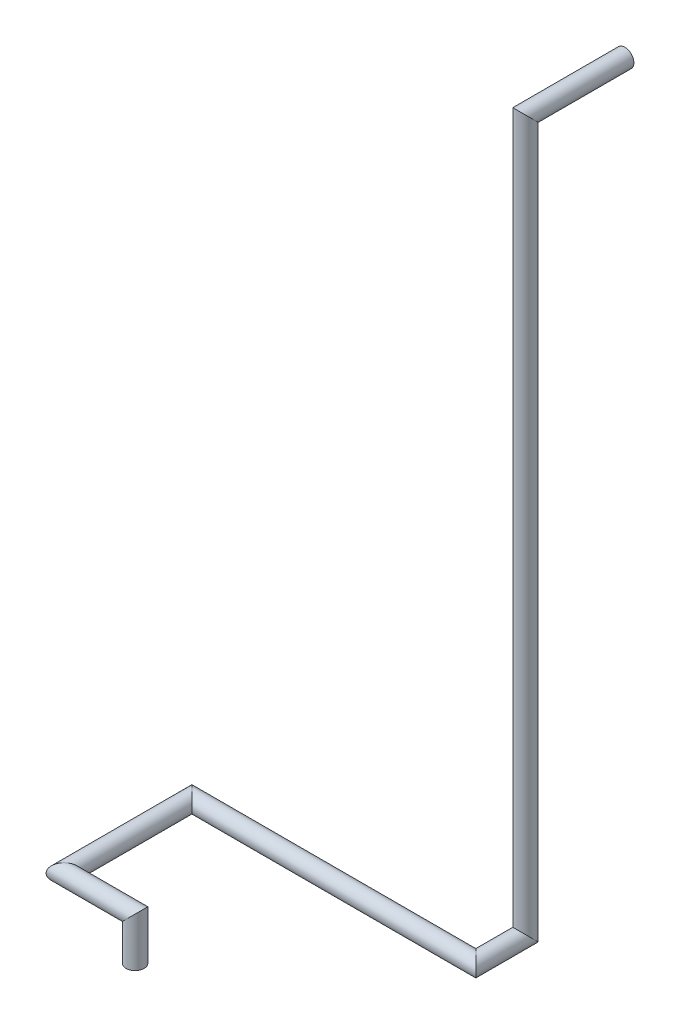
from build123d import *

# Parameters (mm, degrees)
CROQUIS1_R              = 12.7
SALIENTE_EXTRUIR1_DEPTH = 50
CROQUIS2_R              = 12.7


with BuildPart() as part:
    # Croquis1 → Saliente-Extruir1 (new body)
    with BuildSketch(Plane.XY):
        Circle(CROQUIS1_R)
    extrude(amount=SALIENTE_EXTRUIR1_DEPTH)

    # Barrer1: sweep along a curve in space
    with BuildLine() as barrer1_path:
        Line((0, 0, 50), (0, 0, 140))
        Line((0, 0, 140), (0, -1000, 140))
        Line((0, -1000, 140), (0, -1000, 210))
        Line((0, -1000, 210), (-400, -1000, 210))
        Line((-400, -1000, 210), (-400, -1000, 390))
        Line((-400, -1000, 390), (-300, -1000, 390))
        Line((-300, -1000, 390), (-300, -1060, 390))
    # Croquis2 → Barrer1 (sweep)
    with BuildSketch(Plane.XY.offset(50)):
        Circle(CROQUIS2_R)
    sweep(path=barrer1_path.line, transition=Transition.RIGHT)


solid = part.part
